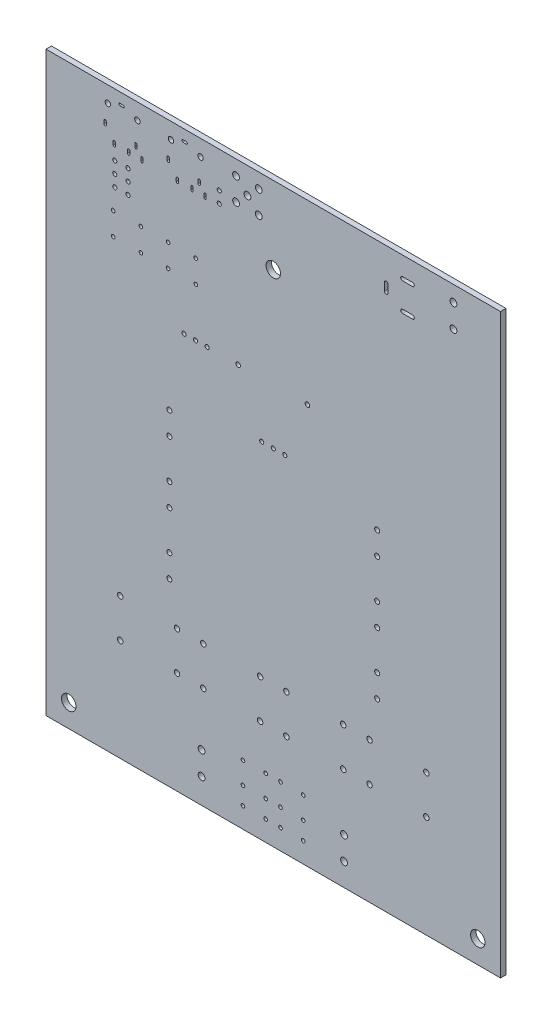
from build123d import *

# Parameters (mm, degrees)
SKETCH_1_W      = 100
SKETCH_1_H      = 127
SKETCH_1_R      = 1.5875
SKETCH_1_R_2    = 0.5999988
SKETCH_1_R_3    = 0.5499989
SKETCH_1_R_4    = 0.3999992
SKETCH_1_R_5    = 0.7499985
SKETCH_1_R_6    = 0.4499991
SKETCH_1_R_7    = 0.499999
EXTRUDE_1_DEPTH = 1.2


with BuildPart() as part:
    # 草图1 → 凸台-拉伸1 (new body)
    with BuildSketch(Plane(origin=(0, 0, 0), x_dir=(-1, 0, 0), z_dir=(0, 0, -1))):
        with Locations((0, 63.5)):
            Rectangle(SKETCH_1_W, SKETCH_1_H)
        with Locations(Location((44.9999989, 5.00000016, 0), (0, 0, 180))):
            Circle(SKETCH_1_R, mode=Mode.SUBTRACT)
        with Locations(Location((33.6820002, 30.99999896, 0), (0, 0, 180))):
            Circle(SKETCH_1_R_2, mode=Mode.SUBTRACT)
        with Locations(Location((33.6820002, 22.50000072, 0), (0, 0, 180))):
            Circle(SKETCH_1_R_2, mode=Mode.SUBTRACT)
        with Locations(Location((22.86, 39.62551638, 0), (0, 0, 180))):
            Circle(SKETCH_1_R_3, mode=Mode.SUBTRACT)
        with Locations(Location((22.86, 53.21451638, 0), (0, 0, 180))):
            Circle(SKETCH_1_R_3, mode=Mode.SUBTRACT)
        with Locations(Location((22.86, 44.62550638, 0), (0, 0, 180))):
            Circle(SKETCH_1_R_3, mode=Mode.SUBTRACT)
        with Locations(Location((35.2298, 98.64279992, 0), (0, 0, 180))):
            Circle(SKETCH_1_R_4, mode=Mode.SUBTRACT)
        with Locations(Location((29.1338, 103.64280008, 0), (0, 0, 180))):
            Circle(SKETCH_1_R_4, mode=Mode.SUBTRACT)
        with Locations(Location((29.1338, 98.64279992, 0), (0, 0, 180))):
            Circle(SKETCH_1_R_4, mode=Mode.SUBTRACT)
        with Locations(Location((22.86, 58.21450638, 0), (0, 0, 180))):
            Circle(SKETCH_1_R_3, mode=Mode.SUBTRACT)
        with Locations(Location((23.14697936, 103.64280008, 0), (0, 0, 180))):
            Circle(SKETCH_1_R_4, mode=Mode.SUBTRACT)
        with Locations(Location((23.14697936, 98.64279992, 0), (0, 0, 180))):
            Circle(SKETCH_1_R_4, mode=Mode.SUBTRACT)
        with Locations(Location((15.7734, 5.5118, 0), (0, 0, 180))):
            Circle(SKETCH_1_R_5, mode=Mode.SUBTRACT)
        with Locations(Location((21.1819998, 30.99999896, 0), (0, 0, 180))):
            Circle(SKETCH_1_R_2, mode=Mode.SUBTRACT)
        with Locations(Location((21.1819998, 22.50000072, 0), (0, 0, 180))):
            Circle(SKETCH_1_R_2, mode=Mode.SUBTRACT)
        with Locations(Location((15.7734, 10.5918, 0), (0, 0, 180))):
            Circle(SKETCH_1_R_5, mode=Mode.SUBTRACT)
        with Locations(Location((15.3940002, 30.99999896, 0), (0, 0, 180))):
            Circle(SKETCH_1_R_2, mode=Mode.SUBTRACT)
        with Locations(Location((15.3940002, 22.50000072, 0), (0, 0, 180))):
            Circle(SKETCH_1_R_2, mode=Mode.SUBTRACT)
        with Locations(Location((22.86, 66.80351638, 0), (0, 0, 180))):
            Circle(SKETCH_1_R_3, mode=Mode.SUBTRACT)
        with Locations(Location((22.86, 71.80350638, 0), (0, 0, 180))):
            Circle(SKETCH_1_R_3, mode=Mode.SUBTRACT)
        with Locations(Location((19.6342, 87.96399984, 0), (0, 0, 180))):
            Circle(SKETCH_1_R_6, mode=Mode.SUBTRACT)
        with Locations(Location((17.0942, 87.96399984, 0), (0, 0, 180))):
            Circle(SKETCH_1_R_6, mode=Mode.SUBTRACT)
        with Locations(Location((17.05935374, 98.64279992, 0), (0, 0, 180))):
            Circle(SKETCH_1_R_4, mode=Mode.SUBTRACT)
        with Locations(Location((14.5542, 87.96399984, 0), (0, 0, 180))):
            Circle(SKETCH_1_R_6, mode=Mode.SUBTRACT)
        with Locations(Location((35.2298, 103.64280008, 0), (0, 0, 180))):
            Circle(SKETCH_1_R_4, mode=Mode.SUBTRACT)
        with Locations(Location((34.8742, 110.7948, 0), (0, 0, 180))):
            Circle(SKETCH_1_R_6, mode=Mode.SUBTRACT)
        with Locations(Location((34.8742, 108.2548, 0), (0, 0, 180))):
            Circle(SKETCH_1_R_6, mode=Mode.SUBTRACT)
        with Locations(Location((31.9532, 108.2548, 0), (0, 0, 180))):
            Circle(SKETCH_1_R_6, mode=Mode.SUBTRACT)
        with Locations(Location((34.8742, 113.3348, 0), (0, 0, 180))):
            Circle(SKETCH_1_R_6, mode=Mode.SUBTRACT)
        with Locations(Location((31.9532, 110.7948, 0), (0, 0, 180))):
            Circle(SKETCH_1_R_6, mode=Mode.SUBTRACT)
        with Locations(Location((36.39534504, 123.47520136, 0), (0, 0, 180))):
            Circle(SKETCH_1_R_2, mode=Mode.SUBTRACT)
        with Locations(Location((31.9532, 113.3348, 0), (0, 0, 180))):
            Circle(SKETCH_1_R_6, mode=Mode.SUBTRACT)
        with Locations(Location((17.05935374, 103.64280008, 0), (0, 0, 180))):
            Circle(SKETCH_1_R_4, mode=Mode.SUBTRACT)
        with Locations(Location((29.89534534, 123.47520136, 0), (0, 0, 180))):
            Circle(SKETCH_1_R_2, mode=Mode.SUBTRACT)
        with Locations(Location((22.5068003, 123.4751912, 0), (0, 0, 180))):
            Circle(SKETCH_1_R_2, mode=Mode.SUBTRACT)
        with Locations(Location((16.0068006, 123.4751912, 0), (0, 0, 180))):
            Circle(SKETCH_1_R_2, mode=Mode.SUBTRACT)
        with Locations(Location((6.67098742, 4.46380108, 0), (0, 0, 180))):
            Circle(SKETCH_1_R_4, mode=Mode.SUBTRACT)
        with Locations(Location((6.67098742, 8.36807064, 0), (0, 0, 180))):
            Circle(SKETCH_1_R_4, mode=Mode.SUBTRACT)
        with Locations(Location((1.67098726, 4.46380108, 0), (0, 0, 180))):
            Circle(SKETCH_1_R_4, mode=Mode.SUBTRACT)
        with Locations(Location((-1.59102552, 4.46380108, 0), (0, 0, 180))):
            Circle(SKETCH_1_R_4, mode=Mode.SUBTRACT)
        with Locations(Location((1.67098726, 8.36807064, 0), (0, 0, 180))):
            Circle(SKETCH_1_R_4, mode=Mode.SUBTRACT)
        with Locations(Location((-1.59102552, 8.36807064, 0), (0, 0, 180))):
            Circle(SKETCH_1_R_4, mode=Mode.SUBTRACT)
        with Locations(Location((6.67098742, 13.16801278, 0), (0, 0, 180))):
            Circle(SKETCH_1_R_4, mode=Mode.SUBTRACT)
        with Locations(Location((2.8939998, 30.99999896, 0), (0, 0, 180))):
            Circle(SKETCH_1_R_2, mode=Mode.SUBTRACT)
        with Locations(Location((2.8939998, 22.50000072, 0), (0, 0, 180))):
            Circle(SKETCH_1_R_2, mode=Mode.SUBTRACT)
        with Locations(Location((1.67098726, 13.16801278, 0), (0, 0, 180))):
            Circle(SKETCH_1_R_4, mode=Mode.SUBTRACT)
        with Locations(Location((-1.59102552, 13.16801278, 0), (0, 0, 180))):
            Circle(SKETCH_1_R_4, mode=Mode.SUBTRACT)
        with Locations(Location((-2.8939998, 30.99999896, 0), (0, 0, 180))):
            Circle(SKETCH_1_R_2, mode=Mode.SUBTRACT)
        with Locations(Location((-6.59102568, 4.46380108, 0), (0, 0, 180))):
            Circle(SKETCH_1_R_4, mode=Mode.SUBTRACT)
        with Locations(Location((-6.59102568, 13.16801278, 0), (0, 0, 180))):
            Circle(SKETCH_1_R_4, mode=Mode.SUBTRACT)
        with Locations(Location((-6.59102568, 8.36807064, 0), (0, 0, 180))):
            Circle(SKETCH_1_R_4, mode=Mode.SUBTRACT)
        with Locations(Location((-44.9999989, 5.00000016, 0), (0, 0, 180))):
            Circle(SKETCH_1_R, mode=Mode.SUBTRACT)
        with Locations(Location((-15.5702, 10.0838, 0), (0, 0, 180))):
            Circle(SKETCH_1_R_5, mode=Mode.SUBTRACT)
        with Locations(Location((-15.5702, 5.0038, 0), (0, 0, 180))):
            Circle(SKETCH_1_R_5, mode=Mode.SUBTRACT)
        with Locations(Location((-21.1819998, 22.50000072, 0), (0, 0, 180))):
            Circle(SKETCH_1_R_2, mode=Mode.SUBTRACT)
        with Locations(Location((-2.8939998, 22.50000072, 0), (0, 0, 180))):
            Circle(SKETCH_1_R_2, mode=Mode.SUBTRACT)
        with Locations(Location((-15.3940002, 22.50000072, 0), (0, 0, 180))):
            Circle(SKETCH_1_R_2, mode=Mode.SUBTRACT)
        with Locations(Location((-33.6820002, 22.50000072, 0), (0, 0, 180))):
            Circle(SKETCH_1_R_2, mode=Mode.SUBTRACT)
        with Locations(Location((-21.1819998, 30.99999896, 0), (0, 0, 180))):
            Circle(SKETCH_1_R_2, mode=Mode.SUBTRACT)
        with Locations(Location((-33.6820002, 30.99999896, 0), (0, 0, 180))):
            Circle(SKETCH_1_R_2, mode=Mode.SUBTRACT)
        with Locations(Location((2.54, 75.92439984, 0), (0, 0, 180))):
            Circle(SKETCH_1_R_6, mode=Mode.SUBTRACT)
        with Locations(Location((11.8872, 116.6114, 0), (0, 0, 180))):
            Circle(SKETCH_1_R_6, mode=Mode.SUBTRACT)
        with Locations(Location((7.7216, 88.01479984, 0), (0, 0, 180))):
            Circle(SKETCH_1_R_7, mode=Mode.SUBTRACT)
        with Locations(Location((-2.54, 75.92439984, 0), (0, 0, 180))):
            Circle(SKETCH_1_R_6, mode=Mode.SUBTRACT)
        with Locations(Location((0, 75.92439984, 0), (0, 0, 180))):
            Circle(SKETCH_1_R_6, mode=Mode.SUBTRACT)
        with Locations(Location((0, 110.00000098, 0), (0, 0, 180))):
            Circle(SKETCH_1_R, mode=Mode.SUBTRACT)
        with Locations(Location((8.18960008, 118.75959992, 0), (0, 0, 180))):
            Circle(SKETCH_1_R_5, mode=Mode.SUBTRACT)
        with Locations(Location((11.8872, 119.1514, 0), (0, 0, 180))):
            Circle(SKETCH_1_R_6, mode=Mode.SUBTRACT)
        with Locations(Location((8.18960008, 123.75960008, 0), (0, 0, 180))):
            Circle(SKETCH_1_R_5, mode=Mode.SUBTRACT)
        with Locations(Location((3.18959992, 118.75959992, 0), (0, 0, 180))):
            Circle(SKETCH_1_R_5, mode=Mode.SUBTRACT)
        with Locations(Location((5.6896, 121.2596, 0), (0, 0, 180))):
            Circle(SKETCH_1_R_5, mode=Mode.SUBTRACT)
        with Locations(Location((3.18959992, 123.75960008, 0), (0, 0, 180))):
            Circle(SKETCH_1_R_5, mode=Mode.SUBTRACT)
        with Locations(Location((-15.3940002, 30.99999896, 0), (0, 0, 180))):
            Circle(SKETCH_1_R_2, mode=Mode.SUBTRACT)
        with Locations(Location((-22.86, 44.62550638, 0), (0, 0, 180))):
            Circle(SKETCH_1_R_3, mode=Mode.SUBTRACT)
        with Locations(Location((-22.86, 39.62551638, 0), (0, 0, 180))):
            Circle(SKETCH_1_R_3, mode=Mode.SUBTRACT)
        with Locations(Location((-22.86, 53.21451638, 0), (0, 0, 180))):
            Circle(SKETCH_1_R_3, mode=Mode.SUBTRACT)
        with Locations(Location((-22.86, 66.80351638, 0), (0, 0, 180))):
            Circle(SKETCH_1_R_3, mode=Mode.SUBTRACT)
        with Locations(Location((-22.86, 58.21450638, 0), (0, 0, 180))):
            Circle(SKETCH_1_R_3, mode=Mode.SUBTRACT)
        with Locations(Location((-22.86, 71.80350638, 0), (0, 0, 180))):
            Circle(SKETCH_1_R_3, mode=Mode.SUBTRACT)
        with Locations(Location((-7.5184, 88.01479984, 0), (0, 0, 180))):
            Circle(SKETCH_1_R_7, mode=Mode.SUBTRACT)
        with Locations(Location((-39.6494, 118.4656, 0), (0, 0, 180))):
            Circle(SKETCH_1_R_5, mode=Mode.SUBTRACT)
        with Locations(Location((-39.6494, 123.5456, 0), (0, 0, 180))):
            Circle(SKETCH_1_R_5, mode=Mode.SUBTRACT)
        with BuildLine():
            Line((35.2453448, 116.82520196), (35.2453448, 116.12520336))
            ThreePointArc((35.2453448, 116.12520336), (34.9953453, 115.87520386), (34.7453458, 116.12520336))
            Line((34.7453458, 116.12520336), (34.7453458, 116.82520196))
            ThreePointArc((34.7453458, 116.82520196), (34.9953453, 117.07520146), (35.2453448, 116.82520196))
        make_face(mode=Mode.SUBTRACT)
        with BuildLine():
            Line((37.24534588, 119.82520104), (37.24534588, 119.12520244))
            ThreePointArc((37.24534588, 119.12520244), (36.99534638, 118.87520294), (36.74534688, 119.12520244))
            Line((36.74534688, 119.12520244), (36.74534688, 119.82520104))
            ThreePointArc((36.74534688, 119.82520104), (36.99534638, 120.07520054), (37.24534588, 119.82520104))
        make_face(mode=Mode.SUBTRACT)
        with BuildLine():
            Line((33.74534526, 124.3252022), (33.04534666, 124.3252022))
            ThreePointArc((33.04534666, 124.3252022), (32.79534716, 124.5752017), (33.04534666, 124.8252012))
            Line((33.04534666, 124.8252012), (33.74534526, 124.8252012))
            ThreePointArc((33.74534526, 124.8252012), (33.99534476, 124.5752017), (33.74534526, 124.3252022))
        make_face(mode=Mode.SUBTRACT)
        with BuildLine():
            Line((32.04534612, 116.82520196), (32.04534612, 116.12520336))
            ThreePointArc((32.04534612, 116.12520336), (31.79534662, 115.87520386), (31.54534712, 116.12520336))
            Line((31.54534712, 116.12520336), (31.54534712, 116.82520196))
            ThreePointArc((31.54534712, 116.82520196), (31.79534662, 117.07520146), (32.04534612, 116.82520196))
        make_face(mode=Mode.SUBTRACT)
        with BuildLine():
            Line((18.15680138, 116.8251918), (18.15680138, 116.1251932))
            ThreePointArc((18.15680138, 116.1251932), (17.90680188, 115.8751937), (17.65680238, 116.1251932))
            Line((17.65680238, 116.1251932), (17.65680238, 116.8251918))
            ThreePointArc((17.65680238, 116.8251918), (17.90680188, 117.0751913), (18.15680138, 116.8251918))
        make_face(mode=Mode.SUBTRACT)
        with BuildLine():
            Line((29.1453443, 116.82520196), (29.1453443, 116.12520336))
            ThreePointArc((29.1453443, 116.12520336), (28.8953448, 115.87520386), (28.6453453, 116.12520336))
            Line((28.6453453, 116.12520336), (28.6453453, 116.82520196))
            ThreePointArc((28.6453453, 116.82520196), (28.8953448, 117.07520146), (29.1453443, 116.82520196))
        make_face(mode=Mode.SUBTRACT)
        with BuildLine():
            Line((21.35680006, 116.8251918), (21.35680006, 116.1251932))
            ThreePointArc((21.35680006, 116.1251932), (21.10680056, 115.8751937), (20.85680106, 116.1251932))
            Line((20.85680106, 116.1251932), (20.85680106, 116.8251918))
            ThreePointArc((20.85680106, 116.8251918), (21.10680056, 117.0751913), (21.35680006, 116.8251918))
        make_face(mode=Mode.SUBTRACT)
        with BuildLine():
            Line((16.5567995, 118.82519034), (16.5567995, 118.12519174))
            ThreePointArc((16.5567995, 118.12519174), (16.3068, 117.87519224), (16.0568005, 118.12519174))
            Line((16.0568005, 118.12519174), (16.0568005, 118.82519034))
            ThreePointArc((16.0568005, 118.82519034), (16.3068, 119.07518984), (16.5567995, 118.82519034))
        make_face(mode=Mode.SUBTRACT)
        with BuildLine():
            Line((15.25679956, 116.8251918), (15.25679956, 116.1251932))
            ThreePointArc((15.25679956, 116.1251932), (15.00680006, 115.8751937), (14.75680056, 116.1251932))
            Line((14.75680056, 116.1251932), (14.75680056, 116.8251918))
            ThreePointArc((14.75680056, 116.8251918), (15.00680006, 117.0751913), (15.25679956, 116.8251918))
        make_face(mode=Mode.SUBTRACT)
        with BuildLine():
            Line((30.44534424, 118.8252005), (30.44534424, 118.1252019))
            ThreePointArc((30.44534424, 118.1252019), (30.19534474, 117.8752024), (29.94534524, 118.1252019))
            Line((29.94534524, 118.1252019), (29.94534524, 118.8252005))
            ThreePointArc((29.94534524, 118.8252005), (30.19534474, 119.0752), (30.44534424, 118.8252005))
        make_face(mode=Mode.SUBTRACT)
        with BuildLine():
            Line((23.35680114, 119.82519088), (23.35680114, 119.12519228))
            ThreePointArc((23.35680114, 119.12519228), (23.10680164, 118.87519278), (22.85680214, 119.12519228))
            Line((22.85680214, 119.12519228), (22.85680214, 119.82519088))
            ThreePointArc((22.85680214, 119.82519088), (23.10680164, 120.07519038), (23.35680114, 119.82519088))
        make_face(mode=Mode.SUBTRACT)
        with BuildLine():
            Line((19.85680052, 124.32519204), (19.15680192, 124.32519204))
            ThreePointArc((19.15680192, 124.32519204), (18.90680242, 124.57519154), (19.15680192, 124.82519104))
            Line((19.15680192, 124.82519104), (19.85680052, 124.82519104))
            ThreePointArc((19.85680052, 124.82519104), (20.10680002, 124.57519154), (19.85680052, 124.32519204))
        make_face(mode=Mode.SUBTRACT)
        with BuildLine():
            Line((-25.24019844, 118.1251892), (-25.24019844, 119.82519088))
            ThreePointArc((-25.24019844, 119.82519088), (-24.84019924, 120.22519008), (-24.44020004, 119.82519088))
            Line((-24.44020004, 119.82519088), (-24.44020004, 118.1251892))
            ThreePointArc((-24.44020004, 118.1251892), (-24.84019924, 117.72519), (-25.24019844, 118.1251892))
        make_face(mode=Mode.SUBTRACT)
        with BuildLine():
            Line((-30.64020034, 116.67518956), (-28.44019966, 116.67518956))
            ThreePointArc((-28.44019966, 116.67518956), (-28.04020046, 116.27519036), (-28.44019966, 115.87519116))
            Line((-28.44019966, 115.87519116), (-30.64020034, 115.87519116))
            ThreePointArc((-30.64020034, 115.87519116), (-31.04019954, 116.27519036), (-30.64020034, 116.67518956))
        make_face(mode=Mode.SUBTRACT)
        with BuildLine():
            Line((-30.64020034, 122.87518986), (-28.44019966, 122.87518986))
            ThreePointArc((-28.44019966, 122.87518986), (-28.04020046, 122.47519066), (-28.44019966, 122.07519146))
            Line((-28.44019966, 122.07519146), (-30.64020034, 122.07519146))
            ThreePointArc((-30.64020034, 122.07519146), (-31.04019954, 122.47519066), (-30.64020034, 122.87518986))
        make_face(mode=Mode.SUBTRACT)
    extrude(amount=-EXTRUDE_1_DEPTH)


solid = part.part
